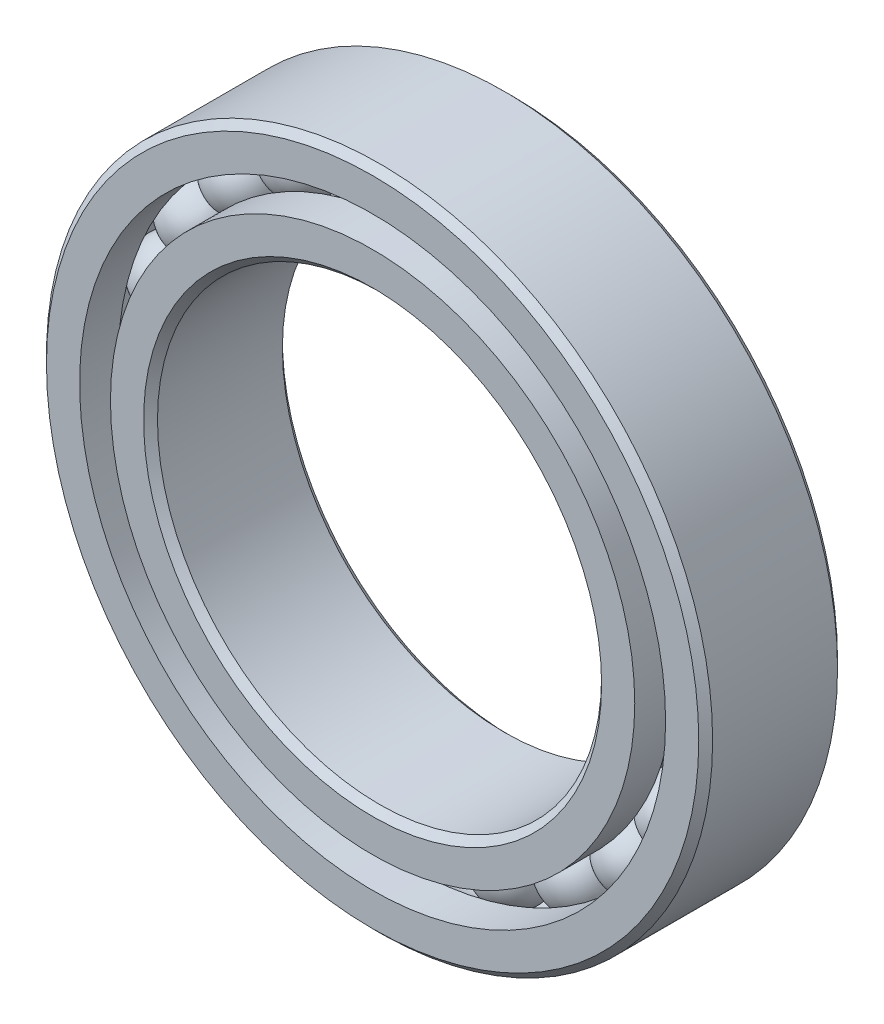
from build123d import *

# Parameters (mm, degrees)
CIRPATTERN1_COUNT = 24


with BuildPart() as part:
    # Sketch2 → Revolve1 (revolve)
    with BuildSketch(Plane(origin=(0, 0, 0), x_dir=(0, 0, -1), z_dir=(1, 0, 0)), mode=Mode.PRIVATE) as revolve1_sk:
        with BuildLine():
            Line((-1.25, 4.722222222), (-0.555555556, 4.722222222))
            ThreePointArc((-0.555555556, 4.722222222), (0, 4.378870006), (0.555555556, 4.722222222))
            Line((0.555555556, 4.722222222), (1.25, 4.722222222))
            Line((1.25, 4.722222222), (1.25, 4.125))
            Line((1.25, 4.125), (1.125, 4))
            Line((1.125, 4), (-1.125, 4))
            Line((-1.125, 4), (-1.25, 4.125))
            Line((-1.25, 4.125), (-1.25, 4.722222222))
        make_face()
        with BuildLine():
            Line((1.125, 6), (1.25, 5.875))
            Line((1.25, 5.875), (1.25, 5.277777778))
            Line((1.25, 5.277777778), (0.555555556, 5.277777778))
            ThreePointArc((0.555555556, 5.277777778), (0, 5.621129994), (-0.555555556, 5.277777778))
            Line((-0.555555556, 5.277777778), (-1.25, 5.277777778))
            Line((-1.25, 5.277777778), (-1.25, 5.875))
            Line((-1.25, 5.875), (-1.125, 6))
            Line((-1.125, 6), (1.125, 6))
        make_face()
    revolve(revolve1_sk.sketch.rotate(Axis((0, 0, 1.25), (0, 0, -1)), 90), axis=Axis((0, 0, 1.25), (0, 0, -1)))


with BuildPart() as body_2:
    # Sketch3 → Revolve2 (revolve)
    with BuildSketch(Plane(origin=(0, 0, 0), x_dir=(0, 0, -1), z_dir=(1, 0, 0))):
        with BuildLine():
            Line((-0.621129994, 5), (0.621129994, 5))
            ThreePointArc((0.621129994, 5), (0, 5.621129994), (-0.621129994, 5))
        make_face()
    revolve(axis=Axis((0, 5, 0.621129994), (0, 0, -1)))


with BuildPart() as cirpattern1_1:
    # CirPattern1: pattern copy
    add(body_2.part.rotate(Axis((0, 0, 0), (0, 0, 1)), 1 * 360 / CIRPATTERN1_COUNT))


with BuildPart() as cirpattern1_2:
    # CirPattern1: pattern copy
    add(body_2.part.rotate(Axis((0, 0, 0), (0, 0, 1)), 2 * 360 / CIRPATTERN1_COUNT))


with BuildPart() as cirpattern1_3:
    # CirPattern1: pattern copy
    add(body_2.part.rotate(Axis((0, 0, 0), (0, 0, 1)), 3 * 360 / CIRPATTERN1_COUNT))


with BuildPart() as cirpattern1_4:
    # CirPattern1: pattern copy
    add(body_2.part.rotate(Axis((0, 0, 0), (0, 0, 1)), 4 * 360 / CIRPATTERN1_COUNT))


with BuildPart() as cirpattern1_5:
    # CirPattern1: pattern copy
    add(body_2.part.rotate(Axis((0, 0, 0), (0, 0, 1)), 5 * 360 / CIRPATTERN1_COUNT))


with BuildPart() as cirpattern1_6:
    # CirPattern1: pattern copy
    add(body_2.part.rotate(Axis((0, 0, 0), (0, 0, 1)), 6 * 360 / CIRPATTERN1_COUNT))


with BuildPart() as cirpattern1_7:
    # CirPattern1: pattern copy
    add(body_2.part.rotate(Axis((0, 0, 0), (0, 0, 1)), 7 * 360 / CIRPATTERN1_COUNT))


with BuildPart() as cirpattern1_8:
    # CirPattern1: pattern copy
    add(body_2.part.rotate(Axis((0, 0, 0), (0, 0, 1)), 8 * 360 / CIRPATTERN1_COUNT))


with BuildPart() as cirpattern1_9:
    # CirPattern1: pattern copy
    add(body_2.part.rotate(Axis((0, 0, 0), (0, 0, 1)), 9 * 360 / CIRPATTERN1_COUNT))


with BuildPart() as cirpattern1_10:
    # CirPattern1: pattern copy
    add(body_2.part.rotate(Axis((0, 0, 0), (0, 0, 1)), 10 * 360 / CIRPATTERN1_COUNT))


with BuildPart() as cirpattern1_11:
    # CirPattern1: pattern copy
    add(body_2.part.rotate(Axis((0, 0, 0), (0, 0, 1)), 11 * 360 / CIRPATTERN1_COUNT))


with BuildPart() as cirpattern1_12:
    # CirPattern1: pattern copy
    add(body_2.part.rotate(Axis((0, 0, 0), (0, 0, 1)), 12 * 360 / CIRPATTERN1_COUNT))


with BuildPart() as cirpattern1_13:
    # CirPattern1: pattern copy
    add(body_2.part.rotate(Axis((0, 0, 0), (0, 0, 1)), 13 * 360 / CIRPATTERN1_COUNT))


with BuildPart() as cirpattern1_14:
    # CirPattern1: pattern copy
    add(body_2.part.rotate(Axis((0, 0, 0), (0, 0, 1)), 14 * 360 / CIRPATTERN1_COUNT))


with BuildPart() as cirpattern1_15:
    # CirPattern1: pattern copy
    add(body_2.part.rotate(Axis((0, 0, 0), (0, 0, 1)), 15 * 360 / CIRPATTERN1_COUNT))


with BuildPart() as cirpattern1_16:
    # CirPattern1: pattern copy
    add(body_2.part.rotate(Axis((0, 0, 0), (0, 0, 1)), 16 * 360 / CIRPATTERN1_COUNT))


with BuildPart() as cirpattern1_17:
    # CirPattern1: pattern copy
    add(body_2.part.rotate(Axis((0, 0, 0), (0, 0, 1)), 17 * 360 / CIRPATTERN1_COUNT))


with BuildPart() as cirpattern1_18:
    # CirPattern1: pattern copy
    add(body_2.part.rotate(Axis((0, 0, 0), (0, 0, 1)), 18 * 360 / CIRPATTERN1_COUNT))


with BuildPart() as cirpattern1_19:
    # CirPattern1: pattern copy
    add(body_2.part.rotate(Axis((0, 0, 0), (0, 0, 1)), 19 * 360 / CIRPATTERN1_COUNT))


with BuildPart() as cirpattern1_20:
    # CirPattern1: pattern copy
    add(body_2.part.rotate(Axis((0, 0, 0), (0, 0, 1)), 20 * 360 / CIRPATTERN1_COUNT))


with BuildPart() as cirpattern1_21:
    # CirPattern1: pattern copy
    add(body_2.part.rotate(Axis((0, 0, 0), (0, 0, 1)), 21 * 360 / CIRPATTERN1_COUNT))


with BuildPart() as cirpattern1_22:
    # CirPattern1: pattern copy
    add(body_2.part.rotate(Axis((0, 0, 0), (0, 0, 1)), 22 * 360 / CIRPATTERN1_COUNT))


with BuildPart() as cirpattern1_23:
    # CirPattern1: pattern copy
    add(body_2.part.rotate(Axis((0, 0, 0), (0, 0, 1)), 23 * 360 / CIRPATTERN1_COUNT))


solid = Compound([part.part, body_2.part, cirpattern1_1.part, cirpattern1_2.part, cirpattern1_3.part, cirpattern1_4.part, cirpattern1_5.part, cirpattern1_6.part, cirpattern1_7.part, cirpattern1_8.part, cirpattern1_9.part, cirpattern1_10.part, cirpattern1_11.part, cirpattern1_12.part, cirpattern1_13.part, cirpattern1_14.part, cirpattern1_15.part, cirpattern1_16.part, cirpattern1_17.part, cirpattern1_18.part, cirpattern1_19.part, cirpattern1_20.part, cirpattern1_21.part, cirpattern1_22.part, cirpattern1_23.part])
